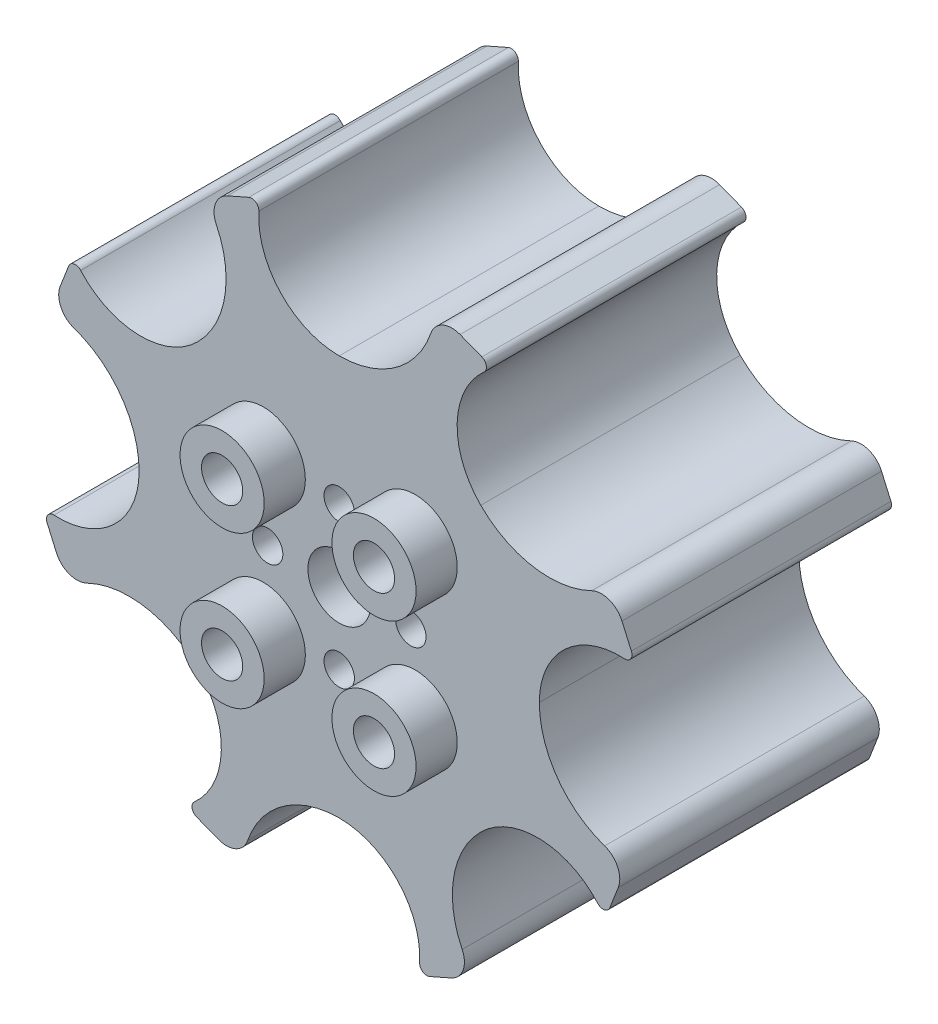
from build123d import *

# Parameters (mm, degrees)
EXTRUDE_1_DEPTH     = 25
CUT_EXTRUDE_1_DEPTH = 53.585134746
EXTRUDE_2_DEPTH     = 4
SKETCH_4_R          = 3.5
SKETCH_4_R_2        = 1.7
SKETCH_4_R_3        = 2.3
CUT_EXTRUDE_2_DEPTH = 55.600333298
EXTRUDE_START       = 4.6
SKETCH_5_R          = 4.7
SKETCH_5_R_2        = 2.3
EXTRUDE_3_DEPTH     = 4.6


with BuildPart() as part:
    # 草图1 → 凸台-拉伸1 (new body)
    with BuildSketch(Plane.XY):
        with BuildLine():
            Line((15.936762996, 30.229618981), (13.50337588, 31.175538906))
            ThreePointArc((13.50337588, 31.175538906), (11.545587701, 31.113280948), (10.233613318, 29.658793469))
            ThreePointArc((10.233613318, 29.658793469), (6.285609854, 24.369935979), (0, 22.357511157))
            ThreePointArc((0, 22.357511157), (-6.541634269, 25.176328334), (-8.985563862, 31.867062025))
            ThreePointArc((-8.985563862, 31.867062025), (-9.328351981, 32.569720668), (-10.106575389, 32.644561759))
            Line((-10.106575389, 32.644561759), (-12.496106314, 31.592763621))
            ThreePointArc((-12.496106314, 31.592763621), (-13.836448588, 30.1643753), (-13.73567661, 28.208191357))
            ThreePointArc((-13.73567661, 28.208191357), (-12.787549636, 21.67674434), (-15.80914775, 15.80914775))
            ThreePointArc((-15.80914775, 15.80914775), (-22.427986442, 13.176718539), (-28.887168794, 16.179662515))
            ThreePointArc((-28.887168794, 16.179662515), (-29.626411288, 16.434129403), (-30.229618981, 15.936762996))
            Line((-30.229618981, 15.936762996), (-31.175538906, 13.50337588))
            ThreePointArc((-31.175538906, 13.50337588), (-31.113280948, 11.545587701), (-29.658793469, 10.233613318))
            ThreePointArc((-29.658793469, 10.233613318), (-24.369935979, 6.285609854), (-22.357511157, 0))
            ThreePointArc((-22.357511157, 0), (-25.176328334, -6.541634269), (-31.867062025, -8.985563862))
            ThreePointArc((-31.867062025, -8.985563862), (-32.569720668, -9.328351981), (-32.644561759, -10.106575389))
            Line((-32.644561759, -10.106575389), (-31.592763621, -12.496106314))
            ThreePointArc((-31.592763621, -12.496106314), (-30.1643753, -13.836448588), (-28.208191357, -13.73567661))
            ThreePointArc((-28.208191357, -13.73567661), (-21.67674434, -12.787549636), (-15.80914775, -15.80914775))
            ThreePointArc((-15.80914775, -15.80914775), (-13.176718539, -22.427986442), (-16.179662515, -28.887168794))
            ThreePointArc((-16.179662515, -28.887168794), (-16.434129403, -29.626411288), (-15.936762996, -30.229618981))
            Line((-15.936762996, -30.229618981), (-13.50337588, -31.175538906))
            ThreePointArc((-13.50337588, -31.175538906), (-11.545587701, -31.113280948), (-10.233613318, -29.658793469))
            ThreePointArc((-10.233613318, -29.658793469), (-6.285609854, -24.369935979), (0, -22.357511157))
            ThreePointArc((0, -22.357511157), (6.541634269, -25.176328334), (8.985563862, -31.867062025))
            ThreePointArc((8.985563862, -31.867062025), (9.328351981, -32.569720668), (10.106575389, -32.644561759))
            Line((10.106575389, -32.644561759), (12.496106314, -31.592763621))
            ThreePointArc((12.496106314, -31.592763621), (13.836448588, -30.1643753), (13.73567661, -28.208191357))
            ThreePointArc((13.73567661, -28.208191357), (12.787549636, -21.67674434), (15.80914775, -15.80914775))
            ThreePointArc((15.80914775, -15.80914775), (22.427986442, -13.176718539), (28.887168794, -16.179662515))
            ThreePointArc((28.887168794, -16.179662515), (29.626411288, -16.434129403), (30.229618981, -15.936762996))
            Line((30.229618981, -15.936762996), (31.175538906, -13.50337588))
            ThreePointArc((31.175538906, -13.50337588), (31.113280948, -11.545587701), (29.658793469, -10.233613318))
            ThreePointArc((29.658793469, -10.233613318), (24.369935979, -6.285609854), (22.357511157, 0))
            ThreePointArc((22.357511157, 0), (25.176328334, 6.541634269), (31.867062025, 8.985563862))
            ThreePointArc((31.867062025, 8.985563862), (32.569720668, 9.328351981), (32.644561759, 10.106575389))
            Line((32.644561759, 10.106575389), (31.592763621, 12.496106314))
            ThreePointArc((31.592763621, 12.496106314), (30.1643753, 13.836448588), (28.208191357, 13.73567661))
            ThreePointArc((28.208191357, 13.73567661), (21.67674434, 12.787549636), (15.80914775, 15.80914775))
            ThreePointArc((15.80914775, 15.80914775), (13.176718539, 22.427986442), (16.179662515, 28.887168794))
            ThreePointArc((16.179662515, 28.887168794), (16.434129403, 29.626411288), (15.936762996, 30.229618981))
        make_face()
    extrude(amount=EXTRUDE_1_DEPTH)

    # 草图2 → 切除-拉伸1 (cut, through all)
    with BuildSketch(Plane(origin=(0, 0, 0), x_dir=(-1, 0, 0), z_dir=(0, 0, -1))):
        with BuildLine():
            ThreePointArc((19.357511157, 0), (20.023485618, -3.942063555), (21.947488669, -7.446574835))
            ThreePointArc((21.947488669, -7.446574835), (22.173796823, -8.909207499), (21.034627917, -9.854090504))
            ThreePointArc((21.034627917, -9.854090504), (17.067163124, -11.207426936), (13.687827406, -13.687827406))
            ThreePointArc((13.687827406, -13.687827406), (11.371282592, -16.946202335), (10.253694505, -20.78474163))
            ThreePointArc((10.253694505, -20.78474163), (9.379481061, -21.979003136), (7.905833822, -21.841622258))
            ThreePointArc((7.905833822, -21.841622258), (4.143459195, -19.993154366), (0, -19.357511157))
            ThreePointArc((0, -19.357511157), (-3.942063555, -20.023485618), (-7.446574835, -21.947488669))
            ThreePointArc((-7.446574835, -21.947488669), (-8.909207499, -22.173796823), (-9.854090504, -21.034627917))
            ThreePointArc((-9.854090504, -21.034627917), (-11.207426936, -17.067163124), (-13.687827406, -13.687827406))
            ThreePointArc((-13.687827406, -13.687827406), (-16.946202335, -11.371282592), (-20.78474163, -10.253694505))
            ThreePointArc((-20.78474163, -10.253694505), (-21.979003136, -9.379481061), (-21.841622258, -7.905833822))
            ThreePointArc((-21.841622258, -7.905833822), (-19.993154366, -4.143459195), (-19.357511157, 0))
            ThreePointArc((-19.357511157, 0), (-20.023485618, 3.942063555), (-21.947488669, 7.446574835))
            ThreePointArc((-21.947488669, 7.446574835), (-22.173796823, 8.909207499), (-21.034627917, 9.854090504))
            ThreePointArc((-21.034627917, 9.854090504), (-17.067163124, 11.207426936), (-13.687827406, 13.687827406))
            ThreePointArc((-13.687827406, 13.687827406), (-11.371282592, 16.946202335), (-10.253694505, 20.78474163))
            ThreePointArc((-10.253694505, 20.78474163), (-9.379481061, 21.979003136), (-7.905833822, 21.841622258))
            ThreePointArc((-7.905833822, 21.841622258), (-4.143459195, 19.993154366), (0, 19.357511157))
            ThreePointArc((0, 19.357511157), (3.942063555, 20.023485618), (7.446574835, 21.947488669))
            ThreePointArc((7.446574835, 21.947488669), (8.909207499, 22.173796823), (9.854090504, 21.034627917))
            ThreePointArc((9.854090504, 21.034627917), (11.207426936, 17.067163124), (13.687827406, 13.687827406))
            ThreePointArc((13.687827406, 13.687827406), (16.946202335, 11.371282592), (20.78474163, 10.253694505))
            ThreePointArc((20.78474163, 10.253694505), (21.979003136, 9.379481061), (21.841622258, 7.905833822))
            ThreePointArc((21.841622258, 7.905833822), (19.993154366, 4.143459195), (19.357511157, 0))
        make_face()
    extrude(amount=-CUT_EXTRUDE_1_DEPTH, mode=Mode.SUBTRACT)

    # 草图3 → 凸台-拉伸2 (add)
    with BuildSketch(Plane.XY.offset(25)):
        with BuildLine():
            Line((15.936762996, 30.229618981), (13.50337588, 31.175538906))
            ThreePointArc((13.50337588, 31.175538906), (11.545587701, 31.113280948), (10.233613318, 29.658793469))
            ThreePointArc((10.233613318, 29.658793469), (6.285609854, 24.369935979), (0, 22.357511157))
            ThreePointArc((0, 22.357511157), (-6.541634269, 25.176328334), (-8.985563862, 31.867062025))
            ThreePointArc((-8.985563862, 31.867062025), (-9.328351981, 32.569720668), (-10.106575389, 32.644561759))
            Line((-10.106575389, 32.644561759), (-12.496106314, 31.592763621))
            ThreePointArc((-12.496106314, 31.592763621), (-13.836448588, 30.1643753), (-13.73567661, 28.208191357))
            ThreePointArc((-13.73567661, 28.208191357), (-12.787549636, 21.67674434), (-15.80914775, 15.80914775))
            ThreePointArc((-15.80914775, 15.80914775), (-22.427986442, 13.176718539), (-28.887168794, 16.179662515))
            ThreePointArc((-28.887168794, 16.179662515), (-29.626411288, 16.434129403), (-30.229618981, 15.936762996))
            Line((-30.229618981, 15.936762996), (-31.175538906, 13.50337588))
            ThreePointArc((-31.175538906, 13.50337588), (-31.113280948, 11.545587701), (-29.658793469, 10.233613318))
            ThreePointArc((-29.658793469, 10.233613318), (-24.369935979, 6.285609854), (-22.357511157, 0))
            ThreePointArc((-22.357511157, 0), (-25.176328334, -6.541634269), (-31.867062025, -8.985563862))
            ThreePointArc((-31.867062025, -8.985563862), (-32.569720668, -9.328351981), (-32.644561759, -10.106575389))
            Line((-32.644561759, -10.106575389), (-31.592763621, -12.496106314))
            ThreePointArc((-31.592763621, -12.496106314), (-30.1643753, -13.836448588), (-28.208191357, -13.73567661))
            ThreePointArc((-28.208191357, -13.73567661), (-21.67674434, -12.787549636), (-15.80914775, -15.80914775))
            ThreePointArc((-15.80914775, -15.80914775), (-13.176718539, -22.427986442), (-16.179662515, -28.887168794))
            ThreePointArc((-16.179662515, -28.887168794), (-16.434129403, -29.626411288), (-15.936762996, -30.229618981))
            Line((-15.936762996, -30.229618981), (-13.50337588, -31.175538906))
            ThreePointArc((-13.50337588, -31.175538906), (-11.545587701, -31.113280948), (-10.233613318, -29.658793469))
            ThreePointArc((-10.233613318, -29.658793469), (-6.285609854, -24.369935979), (0, -22.357511157))
            ThreePointArc((0, -22.357511157), (6.541634269, -25.176328334), (8.985563862, -31.867062025))
            ThreePointArc((8.985563862, -31.867062025), (9.328351981, -32.569720668), (10.106575389, -32.644561759))
            Line((10.106575389, -32.644561759), (12.496106314, -31.592763621))
            ThreePointArc((12.496106314, -31.592763621), (13.836448588, -30.1643753), (13.73567661, -28.208191357))
            ThreePointArc((13.73567661, -28.208191357), (12.787549636, -21.67674434), (15.80914775, -15.80914775))
            ThreePointArc((15.80914775, -15.80914775), (22.427986442, -13.176718539), (28.887168794, -16.179662515))
            ThreePointArc((28.887168794, -16.179662515), (29.626411288, -16.434129403), (30.229618981, -15.936762996))
            Line((30.229618981, -15.936762996), (31.175538906, -13.50337588))
            ThreePointArc((31.175538906, -13.50337588), (31.113280948, -11.545587701), (29.658793469, -10.233613318))
            ThreePointArc((29.658793469, -10.233613318), (24.369935979, -6.285609854), (22.357511157, 0))
            ThreePointArc((22.357511157, 0), (25.176328334, 6.541634269), (31.867062025, 8.985563862))
            ThreePointArc((31.867062025, 8.985563862), (32.569720668, 9.328351981), (32.644561759, 10.106575389))
            Line((32.644561759, 10.106575389), (31.592763621, 12.496106314))
            ThreePointArc((31.592763621, 12.496106314), (30.1643753, 13.836448588), (28.208191357, 13.73567661))
            ThreePointArc((28.208191357, 13.73567661), (21.67674434, 12.787549636), (15.80914775, 15.80914775))
            ThreePointArc((15.80914775, 15.80914775), (13.176718539, 22.427986442), (16.179662515, 28.887168794))
            ThreePointArc((16.179662515, 28.887168794), (16.434129403, 29.626411288), (15.936762996, 30.229618981))
        make_face()
    extrude(amount=EXTRUDE_2_DEPTH)

    # 草图4 → 切除-拉伸2 (cut, through all)
    with BuildSketch(Plane.XY.offset(29)):
        Circle(SKETCH_4_R)
        with Locations((8, 0)):
            Circle(SKETCH_4_R_2)
        with Locations((0, -8)):
            Circle(SKETCH_4_R_2)
        with Locations((-8, 0)):
            Circle(SKETCH_4_R_2)
        with Locations((0, 8)):
            Circle(SKETCH_4_R_2)
        with Locations((8.485281374, 8.485281374)):
            Circle(SKETCH_4_R_3)
        with Locations((8.485281374, -8.485281374)):
            Circle(SKETCH_4_R_3)
        with Locations((-8.485281374, -8.485281374)):
            Circle(SKETCH_4_R_3)
        with Locations((-8.485281374, 8.485281374)):
            Circle(SKETCH_4_R_3)
    extrude(amount=-CUT_EXTRUDE_2_DEPTH, mode=Mode.SUBTRACT)

    # 草图5 → 凸台-拉伸3 (add)
    # profile 1 of 4: a face of its own
    with BuildSketch(Plane.XY.offset(29).offset(EXTRUDE_START)):
        with Locations((-8.485281374, 8.485281374)):
            Circle(SKETCH_5_R)
        with Locations((-8.485281374, 8.485281374)):
            Circle(SKETCH_5_R_2, mode=Mode.SUBTRACT)
    # profile 2 of 4: a face of its own
    with BuildSketch(Plane.XY.offset(29).offset(EXTRUDE_START)):
        with Locations((8.485281374, 8.485281374)):
            Circle(SKETCH_5_R)
        with Locations((8.485281374, 8.485281374)):
            Circle(SKETCH_5_R_2, mode=Mode.SUBTRACT)
    # profile 3 of 4: a face of its own
    with BuildSketch(Plane.XY.offset(29).offset(EXTRUDE_START)):
        with Locations((8.485281374, -8.485281374)):
            Circle(SKETCH_5_R)
        with Locations((8.485281374, -8.485281374)):
            Circle(SKETCH_5_R_2, mode=Mode.SUBTRACT)
    # profile 4 of 4: a face of its own
    with BuildSketch(Plane.XY.offset(29).offset(EXTRUDE_START)):
        with Locations((-8.485281374, -8.485281374)):
            Circle(SKETCH_5_R)
        with Locations((-8.485281374, -8.485281374)):
            Circle(SKETCH_5_R_2, mode=Mode.SUBTRACT)
    extrude(amount=-EXTRUDE_3_DEPTH)


solid = part.part
